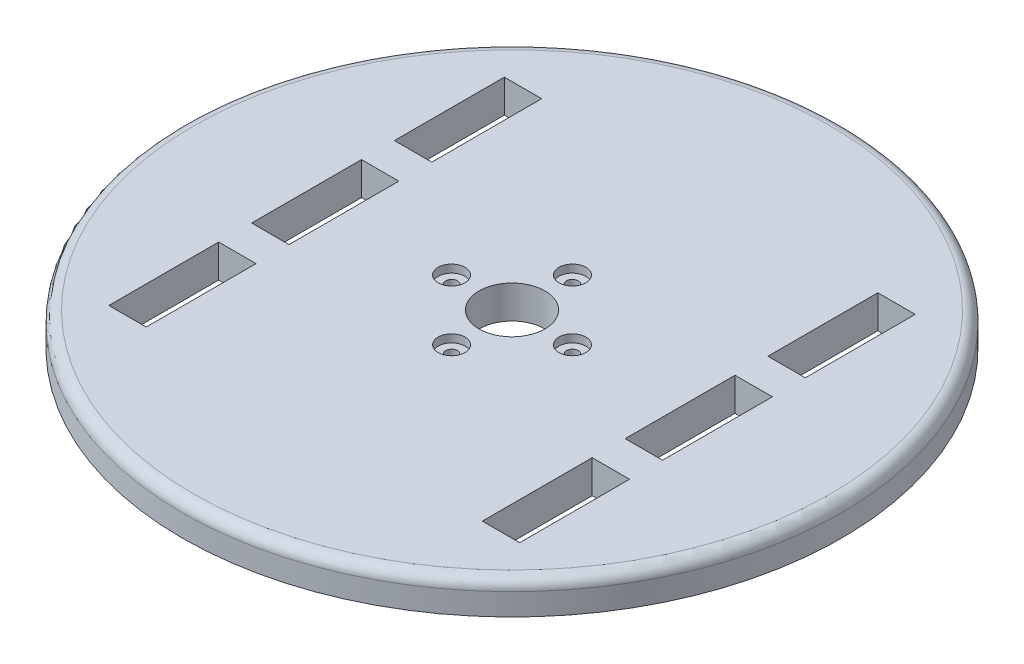
from build123d import *

# Parameters (mm, degrees)
SKETCH1_R                               = 150
SKETCH1_R_2                             = 15
BOSS_EXTRUDE1_DEPTH                     = 15
CBORE_FOR_M5_HEX_HEAD_BOLT1_D           = 5.3
CBORE_FOR_M5_HEX_HEAD_BOLT1_CBORE_D     = 12.24
CBORE_FOR_M5_HEX_HEAD_BOLT1_CBORE_DEPTH = 3.58
CIRPATTERN1_COUNT                       = 4
SKETCH5_W                               = 17
SKETCH5_H                               = 50
CUT_EXTRUDE1_DEPTH                      = 213.661703181
FILLET1_R                               = 5


with BuildPart() as part:
    # Sketch1 → Boss-Extrude1 (new body)
    with BuildSketch(Plane(origin=(0, 0, 0), x_dir=(1, 0, 0), z_dir=(0, 1, 0))):
        with Locations(Location((0, 0, 0), (0, 0, 270))):
            Circle(SKETCH1_R)
        with Locations(Location((0, 0, 0), (0, 0, 270))):
            Circle(SKETCH1_R_2, mode=Mode.SUBTRACT)
    extrude(amount=BOSS_EXTRUDE1_DEPTH)

    # CBORE for M5 Hex Head Bolt1 (through all)
    with Locations(Plane(origin=(0, 15, -27.5), x_dir=(0, 0, 1), z_dir=(0, 1, 0))):
        with Locations((0, 0)):
            cbore_for_m5_hex_head_bolt1 = CounterBoreHole(CBORE_FOR_M5_HEX_HEAD_BOLT1_D / 2, CBORE_FOR_M5_HEX_HEAD_BOLT1_CBORE_D / 2, CBORE_FOR_M5_HEX_HEAD_BOLT1_CBORE_DEPTH)

    # CirPattern1: CBORE for M5 Hex Head Bolt1 ×4 about axis
    cirpattern1_axis = Axis((0, 0, 0), (0, 1, 0))
    for i in range(1, CIRPATTERN1_COUNT):
        add(cbore_for_m5_hex_head_bolt1.rotate(cirpattern1_axis, i * 360 / CIRPATTERN1_COUNT), mode=Mode.SUBTRACT)

    # Sketch5 → Cut-Extrude1 (cut, through all)
    with BuildSketch(Plane.XZ):
        with Locations((-85, 65)):
            Rectangle(SKETCH5_W, SKETCH5_H)
        with Locations((-85, 0)):
            Rectangle(SKETCH5_W, SKETCH5_H)
        with Locations((-85, -65)):
            Rectangle(SKETCH5_W, SKETCH5_H)
        with Locations((85, 65)):
            Rectangle(SKETCH5_W, SKETCH5_H)
        with Locations((85, 0)):
            Rectangle(SKETCH5_W, SKETCH5_H)
        with Locations((85, -65)):
            Rectangle(SKETCH5_W, SKETCH5_H)
    extrude(amount=-CUT_EXTRUDE1_DEPTH, mode=Mode.SUBTRACT)

    # Fillet1
    fillet1_edges = [part.edges().sort_by_distance(p)[0] for p in [
        (0, 15, -150),
    ]]
    fillet(fillet1_edges, radius=FILLET1_R)


solid = part.part
